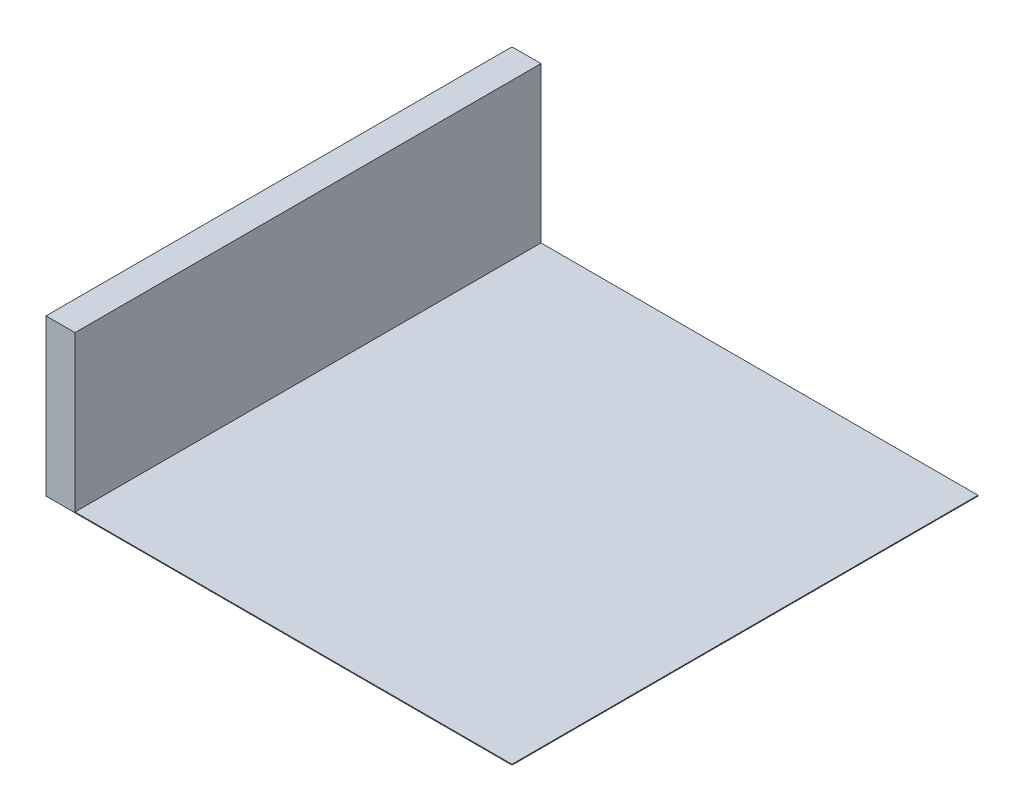
from build123d import *

# Parameters (mm, degrees)
SKETCH1_W           = 1500
SKETCH1_H           = 1500
BOSS_EXTRUDE1_DEPTH = 2.54
SKETCH2_W           = 93.396555276
SKETCH2_H           = 1500
BOSS_EXTRUDE2_DEPTH = 500


with BuildPart() as part:
    # Sketch1 → Boss-Extrude1 (new body)
    with BuildSketch(Plane(origin=(0, 0, 0), x_dir=(1, 0, 0), z_dir=(0, 1, 0))):
        with Locations((622.857901212, 184.481056945)):
            Rectangle(SKETCH1_W, SKETCH1_H)
    extrude(amount=BOSS_EXTRUDE1_DEPTH)

    # Sketch2 → Boss-Extrude2 (add)
    with BuildSketch(Plane(origin=(0, 2.54, 0), x_dir=(1, 0, 0), z_dir=(0, 1, 0))):
        with Locations((-80.44382115, 184.481056945)):
            Rectangle(SKETCH2_W, SKETCH2_H)
    extrude(amount=BOSS_EXTRUDE2_DEPTH)


solid = part.part
